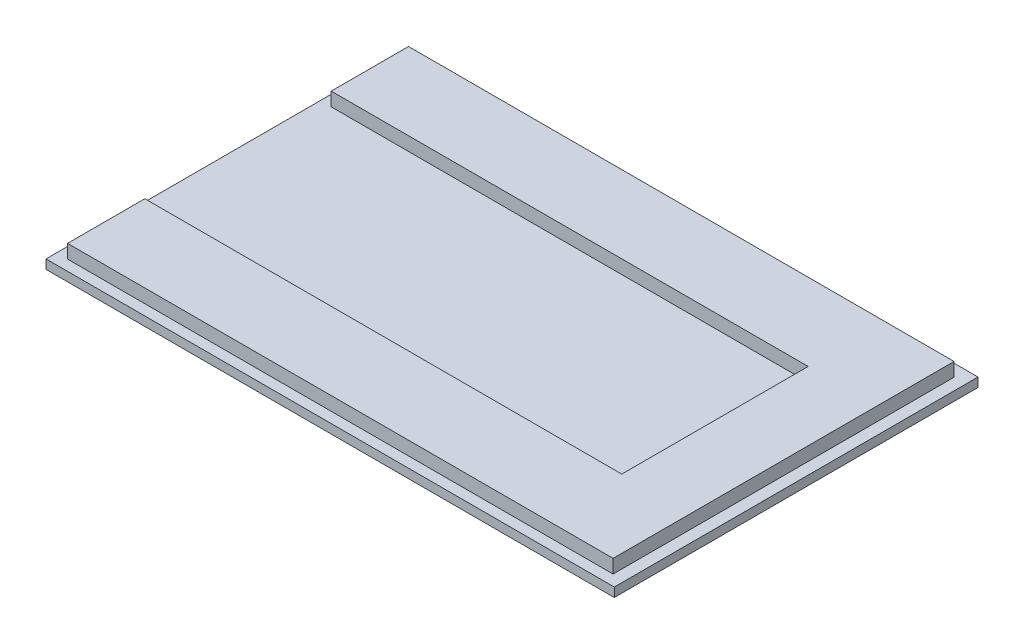
from build123d import *

# Parameters (mm, degrees)
SKETCH1_W           = 125
SKETCH1_H           = 80
BOSS_EXTRUDE1_DEPTH = 2
SKETCH3_W           = 120
SKETCH3_H           = 75
BOSS_EXTRUDE2_DEPTH = 3
SKETCH4_W           = 104.904455421
SKETCH4_H           = 41
CUT_EXTRUDE1_DEPTH  = 3


with BuildPart() as part:
    # Sketch1 → Boss-Extrude1 (new body)
    with BuildSketch(Plane(origin=(0, 0, 0), x_dir=(1, 0, 0), z_dir=(0, 1, 0))):
        with Locations((62.5, 40)):
            Rectangle(SKETCH1_W, SKETCH1_H)
    extrude(amount=BOSS_EXTRUDE1_DEPTH)

    # Sketch3 → Boss-Extrude2 (add)
    with BuildSketch(Plane(origin=(0, 2, 0), x_dir=(1, 0, 0), z_dir=(0, 1, 0))):
        with Locations((62.403820475, 39.836034952)):
            Rectangle(SKETCH3_W, SKETCH3_H)
    extrude(amount=BOSS_EXTRUDE2_DEPTH)

    # Sketch4 → Cut-Extrude1 (cut)
    with BuildSketch(Plane(origin=(0, 5, 0), x_dir=(1, 0, 0), z_dir=(0, 1, 0))):
        with Locations((54.856048186, 39.836034952)):
            Rectangle(SKETCH4_W, SKETCH4_H)
    extrude(amount=-CUT_EXTRUDE1_DEPTH, mode=Mode.SUBTRACT)


solid = part.part
